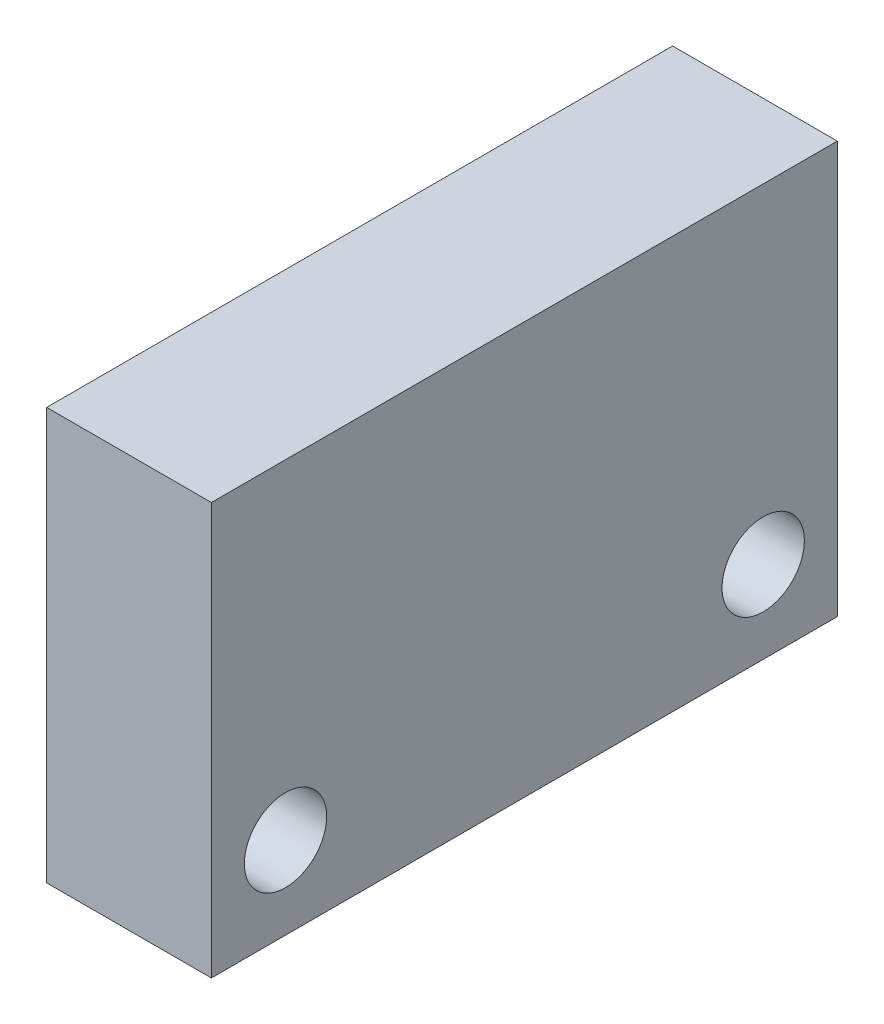
from build123d import *

# Parameters (mm, degrees)
SKETCH1_W           = 20
SKETCH1_H           = 76
BOSS_EXTRUDE1_DEPTH = 50
SKETCH2_R           = 5
CUT_EXTRUDE2_DEPTH  = 66.909028213


with BuildPart() as part:
    # Sketch1 → Boss-Extrude1 (new body)
    with BuildSketch(Plane(origin=(0, 0, 0), x_dir=(1, 0, 0), z_dir=(0, 1, 0))):
        Rectangle(SKETCH1_W, SKETCH1_H)
    extrude(amount=BOSS_EXTRUDE1_DEPTH)

    # Sketch2 → Cut-Extrude2 (cut, through all)
    with BuildSketch(Plane(origin=(10, 0, 0), x_dir=(0, 0, -1), z_dir=(1, 0, 0))):
        with Locations((-29, 10)):
            Circle(SKETCH2_R)
        with Locations((29, 10)):
            Circle(SKETCH2_R)
    extrude(amount=-CUT_EXTRUDE2_DEPTH, mode=Mode.SUBTRACT)


solid = part.part
